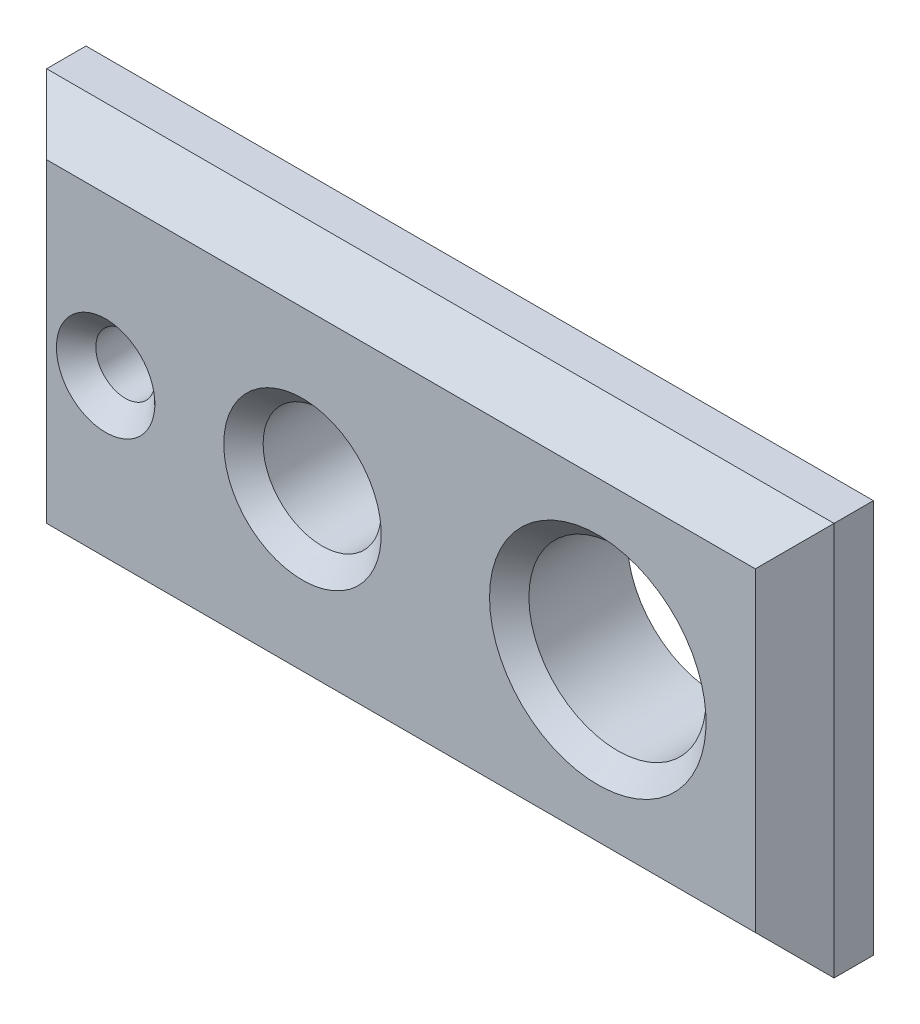
from build123d import *

# Parameters (mm, degrees)
SKETCH1_W           = 200
SKETCH1_H           = 100
BOSS_EXTRUDE1_DEPTH = 15
CHAMFER1_SIZE       = 10
SKETCH2_R           = 7.5
SKETCH2_R_2         = 15
SKETCH2_R_3         = 22.5
CUT_EXTRUDE1_DEPTH  = 30
CHAMFER2_SIZE       = 5


with BuildPart() as part:
    # Sketch1 → Boss-Extrude1 (new, symmetric)
    with BuildSketch(Plane.XY):
        Rectangle(SKETCH1_W, SKETCH1_H)
    extrude(amount=BOSS_EXTRUDE1_DEPTH, both=True)

    # Chamfer1
    chamfer1_edges = [part.edges().sort_by_distance(p)[0] for p in [
        (100, 0, 15),
        (0, 50, 15),
        (-100, 0, 15),
        (0, 50, -15),
        (100, 0, -15),
        (0, -50, -15),
        (-100, 0, -15),
        (0, -50, 15),
    ]]
    chamfer(chamfer1_edges, length=CHAMFER1_SIZE)

    # Sketch2 → Cut-Extrude1 (cut)
    with BuildSketch(Plane.XY.offset(15)):
        with Locations((-75, 0)):
            Circle(SKETCH2_R)
        with Locations((-25, 0)):
            Circle(SKETCH2_R_2)
        with Locations((50, 0)):
            Circle(SKETCH2_R_3)
    extrude(amount=-CUT_EXTRUDE1_DEPTH, mode=Mode.SUBTRACT)

    # Chamfer2
    chamfer2_edges = [part.edges().sort_by_distance(p)[0] for p in [
        (-82.5, 0, 15),
        (-40, 0, 15),
        (27.5, 0, 15),
    ]]
    chamfer(chamfer2_edges, length=CHAMFER2_SIZE)


solid = part.part
